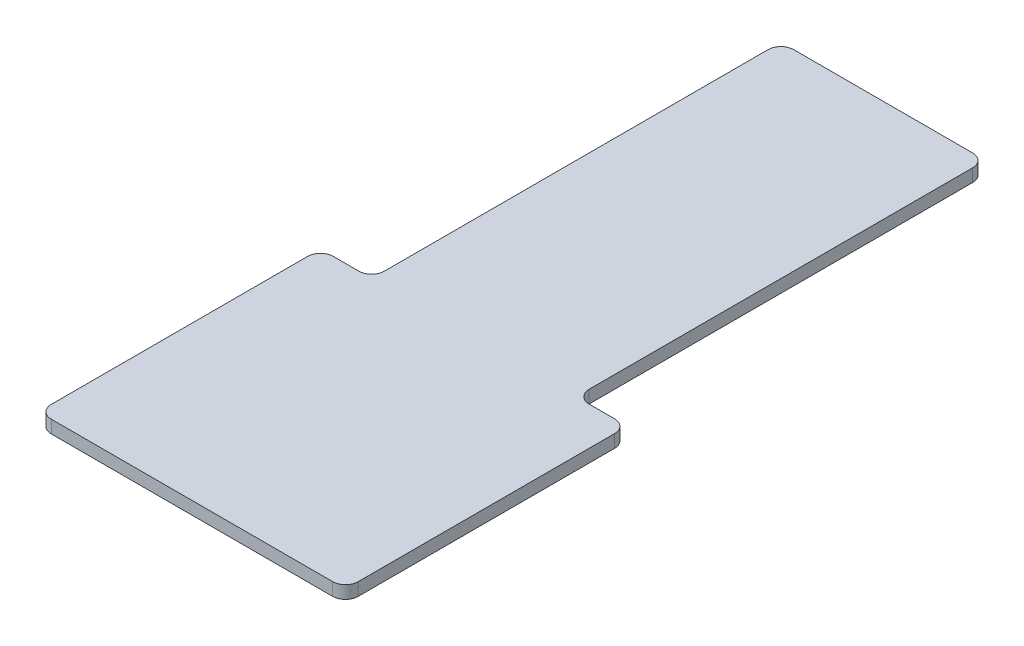
from build123d import *

# Parameters (mm, degrees)
BOSS_EXTRUDE1_DEPTH = 3.175
FILLET1_R           = 3.175


with BuildPart() as part:
    # Sketch1 → Boss-Extrude1 (new body)
    with BuildSketch(Plane(origin=(0, 0, 0), x_dir=(1, 0, 0), z_dir=(0, 1, 0))):
        Polygon((0, 0), (76.2, 0), (76.2, 70), (63.5, 70), (63.5, 171.6), (12.7, 171.6), (12.7, 70), (0, 70), align=None)
    extrude(amount=BOSS_EXTRUDE1_DEPTH)

    # Fillet1
    fillet1_edges = [part.edges().sort_by_distance(p)[0] for p in [
        (0, 1.5875, -70),
        (12.7, 1.5875, -70),
        (12.7, 1.5875, -171.6),
        (63.5, 1.5875, -171.6),
        (63.5, 1.5875, -70),
        (76.2, 1.5875, -70),
        (76.2, 1.5875, 0),
        (0, 1.5875, 0),
    ]]
    fillet(fillet1_edges, radius=FILLET1_R)


solid = part.part
